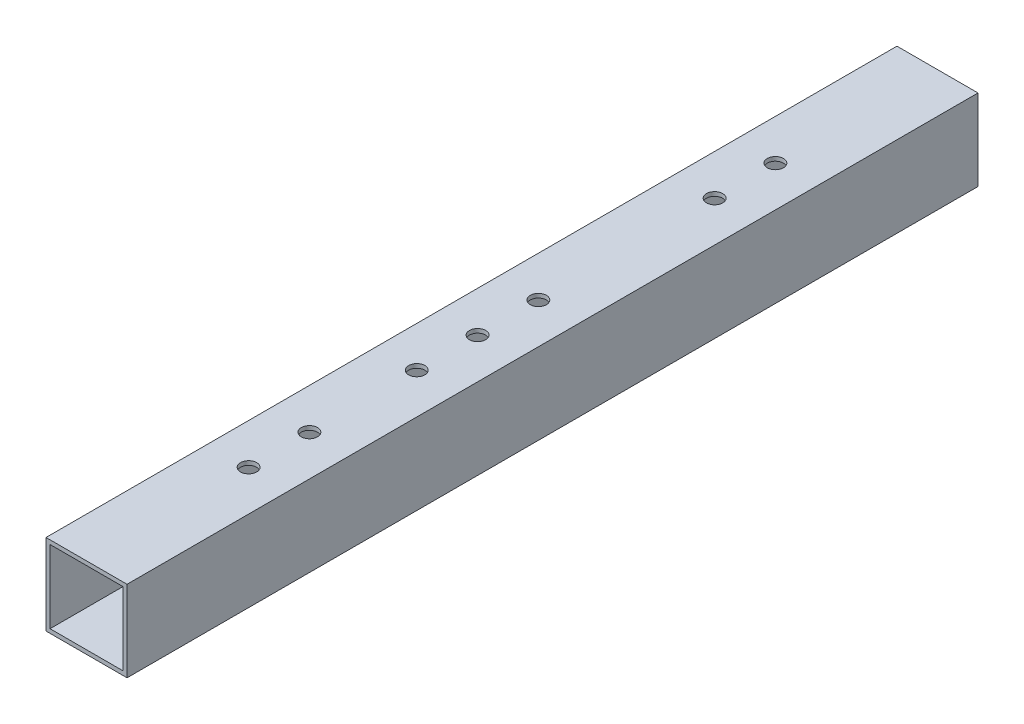
from build123d import *

# Parameters (mm, degrees)
SKETCH_1_W          = 20
SKETCH_1_H          = 20
SKETCH_1_W_2        = 18
SKETCH_1_H_2        = 18
EXTRUDE_1_DEPTH     = 105
SKETCH_2_R          = 2
CUT_EXTRUDE_1_DEPTH = 108.354552768
SKETCH_3_R          = 2
CUT_EXTRUDE_2_DEPTH = 108.354552768


with BuildPart() as part:
    # 草图1 → 凸台-拉伸1 (new, symmetric)
    with BuildSketch(Plane.XY):
        Rectangle(SKETCH_1_W, SKETCH_1_H)
        Rectangle(SKETCH_1_W_2, SKETCH_1_H_2, mode=Mode.SUBTRACT)
    extrude(amount=EXTRUDE_1_DEPTH, both=True)

    # 草图2 → 切除-拉伸1 (cut, through all)
    with BuildSketch(Plane(origin=(0, 10, 0), x_dir=(1, 0, 0), z_dir=(0, 1, 0))):
        with Locations(Location((0, 65, 0), (0, 0, 180))):
            Circle(SKETCH_2_R)
        with Locations(Location((0, -65, 0), (0, 0, 180))):
            Circle(SKETCH_2_R)
        with Locations(Location((0, -50, 0), (0, 0, 180))):
            Circle(SKETCH_2_R)
        with Locations(Location((0, 50, 0), (0, 0, 180))):
            Circle(SKETCH_2_R)
    extrude(amount=-CUT_EXTRUDE_1_DEPTH, mode=Mode.SUBTRACT)

    # 草图3 → 切除-拉伸2 (cut, through all)
    with BuildSketch(Plane(origin=(0, 10, 0), x_dir=(1, 0, 0), z_dir=(0, 1, 0))):
        with Locations(Location((0, -8.5, 0), (0, 0, 180))):
            Circle(SKETCH_3_R)
        with Locations(Location((0, 6.5, 0), (0, 0, 180))):
            Circle(SKETCH_3_R)
        with Locations(Location((0, -23.5, 0), (0, 0, 180))):
            Circle(SKETCH_3_R)
    extrude(amount=-CUT_EXTRUDE_2_DEPTH, mode=Mode.SUBTRACT)


solid = part.part
